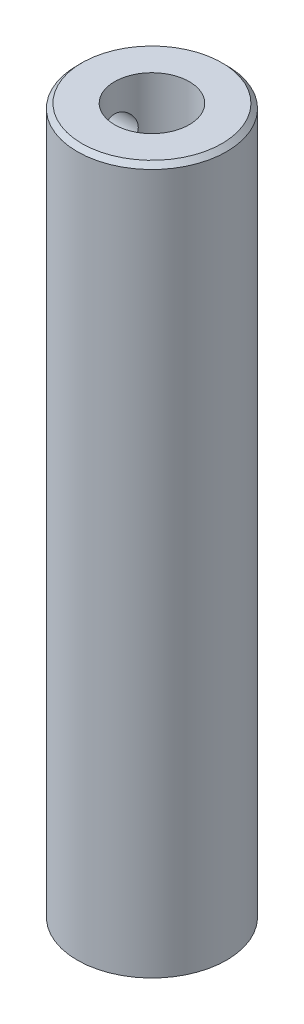
from build123d import *

# Parameters (mm, degrees)
SKETCH_1_R          = 8
EXTRUDE_1_DEPTH     = 75.5
CHAMFER_1_SIZE      = 0.5
SKETCH_3_R          = 4
CUT_EXTRUDE_1_DEPTH = 23
SKETCH_4_R          = 2
CUT_EXTRUDE_2_DEPTH = 23


with BuildPart() as part:
    # 스케치1 → 보스-돌출1 (new body)
    with BuildSketch(Plane(origin=(0, 0, 0), x_dir=(1, 0, 0), z_dir=(0, 1, 0))):
        with Locations(Location((0, 0, 0), (0, 0, 270))):
            Circle(SKETCH_1_R)
    extrude(amount=-EXTRUDE_1_DEPTH)

    # 모따기1
    chamfer_1_edges = [part.edges().sort_by_distance(p)[0] for p in [
        (0, 0, -8),
    ]]
    chamfer(chamfer_1_edges, length=CHAMFER_1_SIZE)

    # 스케치3 → 컷-돌출1 (cut)
    with BuildSketch(Plane(origin=(0, 0, 0), x_dir=(1, 0, 0), z_dir=(0, 1, 0))):
        with Locations(Location((0, 0, 0), (0, 0, 270))):
            Circle(SKETCH_3_R)
    extrude(amount=-CUT_EXTRUDE_1_DEPTH, mode=Mode.SUBTRACT)

    # 스케치4 → 컷-돌출2 (cut)
    with BuildSketch(Plane(origin=(0, 0, 0), x_dir=(0, 0, -1), z_dir=(1, 0, 0))):
        with Locations((0, -5)):
            Circle(SKETCH_4_R)
    extrude(amount=-CUT_EXTRUDE_2_DEPTH, mode=Mode.SUBTRACT)


solid = part.part
